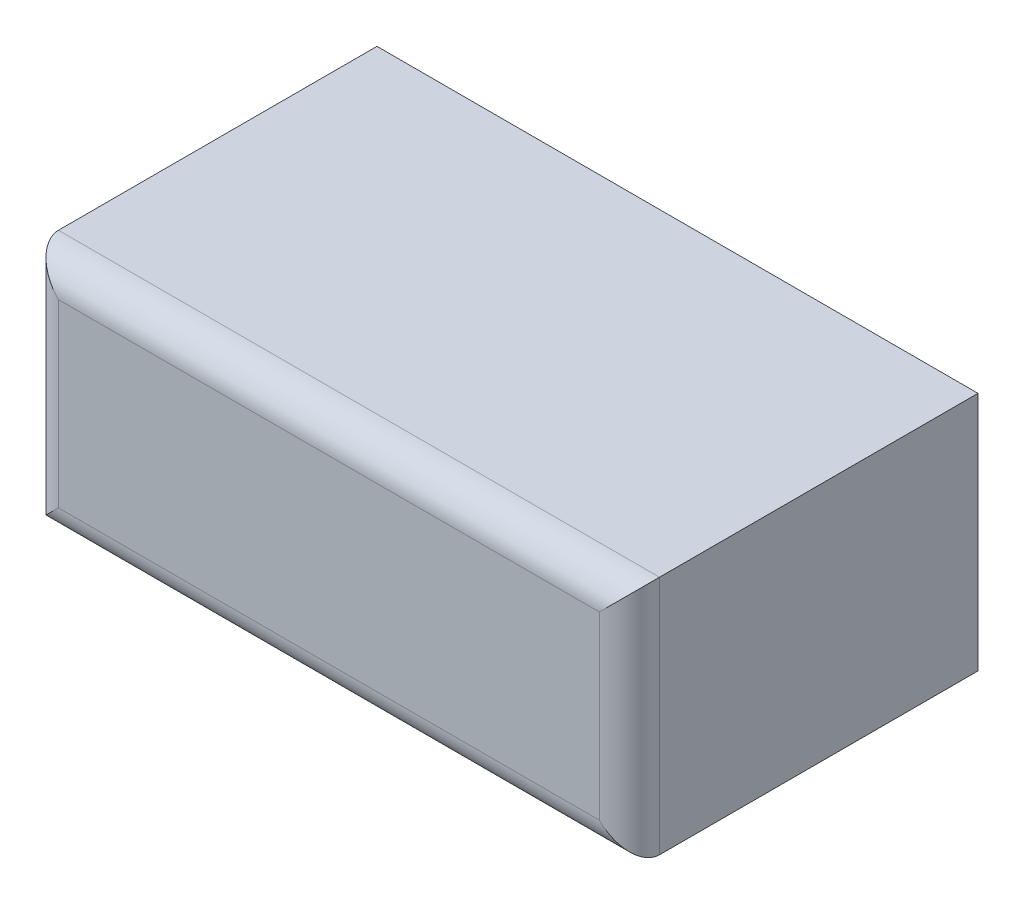
from build123d import *

# Parameters (mm, degrees)
SKETCH1_W           = 50
SKETCH1_H           = 20
BOSS_EXTRUDE1_DEPTH = 29
FILLET1_R           = 2.5
BOSS_EXTRUDE2_DEPTH = 0.1


with BuildPart() as part:
    # Sketch1 → Boss-Extrude1 (new body)
    with BuildSketch(Plane.XY):
        with Locations((0, 20)):
            Rectangle(SKETCH1_W, SKETCH1_H)
    extrude(amount=BOSS_EXTRUDE1_DEPTH)

    # Fillet1
    fillet1_edges = [part.edges().sort_by_distance(p)[0] for p in [
        (0, 10, 29),
        (-25, 20, 29),
        (0, 30, 29),
        (25, 20, 29),
    ]]
    fillet(fillet1_edges, radius=FILLET1_R)

    # Sketch2 → Boss-Extrude2 (add)
    # profile 1 of 7: a face of its own
    with BuildSketch(Plane(origin=(0, 10, 0), x_dir=(-1, 0, 0), z_dir=(0, -1, 0))):
        with BuildLine():
            Line((8.161378205, -16.425), (7.541897035, -16.425))
            add(Edge.make_bspline(
                [(7.541897035, -16.425), (7.511572152, -16.424843079), (7.45279498, -16.424538928), (7.367330986, -16.419712263), (7.287254193, -16.413295668), (7.212706107, -16.402532176), (7.143201655, -16.391371854), (7.079446453, -16.374991174), (7.020906472, -16.356898115), (6.950611937, -16.32905949), (6.870853154, -16.285825753), (6.785127387, -16.221706014), (6.71060932, -16.144831623), (6.647246874, -16.057227192), (6.596397164, -15.96085239), (6.560075042, -15.857780753), (6.536740327, -15.749746338), (6.534370666, -15.675678757), (6.533173077, -15.638246194)],
                knots=[0, 0, 0, 0, 1.00128172, 1.940733171, 2.826250472, 3.653024905, 4.427672124, 5.149348099, 5.824709082, 6.450061444, 7.643590664, 8.808605388, 9.972104426, 11.165284501, 12.367876273, 13.557044126, 14.765369432, 16, 16, 16, 16], degree=3))
            add(Edge.make_bspline(
                [(6.533173077, -15.638246194), (6.534151284, -15.603178326), (6.536073554, -15.534266659), (6.554852574, -15.433813262), (6.583199049, -15.337889273), (6.624104735, -15.247419107), (6.676262921, -15.163197724), (6.739721193, -15.086661725), (6.81496531, -15.019313764), (6.871459009, -14.981833665), (6.900155248, -14.962795473)],
                knots=[0, 0, 0, 0, 1.044356178, 2.052258378, 3.035953355, 4.020338374, 5.002448483, 5.980768927, 6.974322109, 8, 8, 8, 8], degree=3))
            add(Edge.make_bspline(
                [(6.900155248, -14.962795473), (6.864084301, -14.948954147), (6.795071643, -14.922472261), (6.699978414, -14.87547126), (6.618021504, -14.824742321), (6.548144713, -14.769913616), (6.489592899, -14.709194832), (6.437432592, -14.644185038), (6.393165743, -14.572620166), (6.355396245, -14.496050991), (6.3254768, -14.414882995), (6.304708546, -14.329723411), (6.291537252, -14.24153679), (6.289814866, -14.181600564), (6.288942308, -14.151236979)],
                knots=[0, 0, 0, 0, 1.272200328, 2.434034374, 3.488177493, 4.442517805, 5.351202203, 6.260825393, 7.183200622, 8.11705787, 9.069326169, 10.026320267, 11.000137371, 12, 12, 12, 12], degree=3))
            add(Edge.make_bspline(
                [(6.288942308, -14.151236979), (6.289828532, -14.120242797), (6.291572202, -14.059260874), (6.304434247, -13.969675123), (6.326218402, -13.884066271), (6.356202229, -13.801864469), (6.395287658, -13.723551149), (6.442506917, -13.648510856), (6.499179987, -13.577855697), (6.562999438, -13.51056038), (6.634203585, -13.44902172), (6.712664983, -13.396137418), (6.79637275, -13.350459073), (6.886473162, -13.313736246), (6.982326897, -13.284988989), (7.083956408, -13.265113183), (7.191303987, -13.251667075), (7.264973903, -13.250565121), (7.302754407, -13.25)],
                knots=[0, 0, 0, 0, 0.978522333, 1.925270105, 2.85076145, 3.763600118, 4.682725947, 5.609499657, 6.557784645, 7.537954401, 8.534920712, 9.522742111, 10.520247711, 11.5409147, 12.58930695, 13.675078472, 14.807699069, 16, 16, 16, 16], degree=3))
            Line((7.302754407, -13.25), (8.161378205, -13.25))
            Line((8.161378205, -13.25), (8.161378205, -16.425))
        make_face()
        with BuildLine():
            Line((7.876442308, -16.099358974), (7.876442308, -15.081730769))
            Line((7.876442308, -15.081730769), (7.685001002, -15.081730769))
            add(Edge.make_bspline(
                [(7.685001002, -15.081730769), (7.657016485, -15.082090538), (7.602944697, -15.082785683), (7.524432126, -15.084839708), (7.451736127, -15.090339202), (7.384606218, -15.096155836), (7.32349228, -15.105112222), (7.268189891, -15.11607244), (7.218201712, -15.127562175), (7.160582281, -15.147158708), (7.095231966, -15.175817169), (7.026054444, -15.221381864), (6.963791565, -15.274135929), (6.912428283, -15.336710494), (6.869666487, -15.404285365), (6.84087663, -15.477364451), (6.820803271, -15.553429425), (6.819016273, -15.605887766), (6.818108974, -15.632522035)],
                knots=[0, 0, 0, 0, 1.156584208, 2.234756387, 3.244705828, 4.168772894, 5.018724976, 5.795346628, 6.498686023, 7.135894168, 8.308330183, 9.43588092, 10.547699294, 11.667188675, 12.76860303, 13.837480448, 14.902040606, 16, 16, 16, 16], degree=3))
            add(Edge.make_bspline(
                [(6.818108974, -15.632522035), (6.818551479, -15.650154503), (6.819419499, -15.684742514), (6.827602669, -15.735135259), (6.838895347, -15.783089237), (6.857519785, -15.827311694), (6.879584931, -15.869355462), (6.907867177, -15.907892457), (6.940479208, -15.943966652), (6.97850075, -15.976611111), (7.021776377, -16.00613614), (7.07167696, -16.030714317), (7.126845823, -16.052556643), (7.188433408, -16.069113638), (7.255212949, -16.083487745), (7.328203262, -16.092551978), (7.406964459, -16.098374984), (7.46153509, -16.099023662), (7.48974359, -16.099358974)],
                knots=[0, 0, 0, 0, 0.911412742, 1.787835618, 2.63643285, 3.453173233, 4.262886967, 5.08783453, 5.918594724, 6.773969545, 7.67442701, 8.62112486, 9.645634318, 10.739428598, 11.916091468, 13.177237585, 14.540865421, 16, 16, 16, 16], degree=3))
            Line((7.48974359, -16.099358974), (7.876442308, -16.099358974))
        make_face(mode=Mode.SUBTRACT)
        with BuildLine():
            Line((7.876442308, -14.756089744), (7.876442308, -13.575641026))
            Line((7.876442308, -13.575641026), (7.470663061, -13.575641026))
            add(Edge.make_bspline(
                [(7.470663061, -13.575641026), (7.441620225, -13.576022613), (7.385643986, -13.576758072), (7.30476243, -13.578503216), (7.230195825, -13.584977694), (7.161323327, -13.591185023), (7.098463602, -13.601325985), (7.041005232, -13.611145936), (6.990260593, -13.625596478), (6.930886435, -13.64548068), (6.864477035, -13.67725827), (6.791954837, -13.723989938), (6.728077867, -13.780912554), (6.673882733, -13.846455715), (6.628821856, -13.916985641), (6.597648628, -13.992641147), (6.577450151, -14.070895217), (6.575071251, -14.12440248), (6.573878205, -14.151236979)],
                knots=[0, 0, 0, 0, 1.16016216, 2.236059617, 3.229676189, 4.14889023, 4.996733752, 5.772278665, 6.474820656, 7.101410824, 8.271817372, 9.403828207, 10.537358096, 11.673541442, 12.791884111, 13.865947414, 14.929748409, 16, 16, 16, 16], degree=3))
            add(Edge.make_bspline(
                [(6.573878205, -14.151236979), (6.574121742, -14.168015597), (6.574604888, -14.201302193), (6.582199463, -14.250174859), (6.592738789, -14.297751011), (6.608270797, -14.343384407), (6.627060302, -14.387860847), (6.651848446, -14.429733149), (6.67980929, -14.47078375), (6.723116409, -14.523292014), (6.786965959, -14.583060119), (6.877730349, -14.640845611), (6.980355591, -14.688202623), (7.054963889, -14.708222798), (7.093504607, -14.718564704)],
                knots=[0, 0, 0, 0, 0.723354195, 1.435040621, 2.129761981, 2.824182007, 3.512608497, 4.209435533, 4.920062464, 5.654614313, 7.143585817, 8.671381114, 10.280521501, 12, 12, 12, 12], degree=3))
            add(Edge.make_bspline(
                [(7.093504607, -14.718564704), (7.108952416, -14.721699169), (7.14244645, -14.728495336), (7.197063604, -14.735664702), (7.259625939, -14.742095856), (7.329866052, -14.746728084), (7.408063297, -14.751700699), (7.494192553, -14.753565733), (7.58831471, -14.755842106), (7.653622156, -14.756005086), (7.687545072, -14.756089744)],
                knots=[0, 0, 0, 0, 0.634452549, 1.375623993, 2.216454381, 3.166361212, 4.209414599, 5.370755378, 6.634280627, 8, 8, 8, 8], degree=3))
            Line((7.687545072, -14.756089744), (7.876442308, -14.756089744))
        make_face(mode=Mode.SUBTRACT)
    # profile 2 of 7: a face of its own
    with BuildSketch(Plane(origin=(0, 10, 0), x_dir=(-1, 0, 0), z_dir=(0, -1, 0))):
        Polygon((4.335096154, -16.425), (2.869711538, -13.25), (3.179452123, -13.25), (3.648833133, -14.267628205), (5.088141026, -14.267628205), (5.570242388, -13.25), (5.881891026, -13.25), (4.375801282, -16.425), align=None)
        Polygon((4.358628806, -15.80551883), (4.932952724, -14.593269231), (3.798933293, -14.593269231), align=None, mode=Mode.SUBTRACT)
    # profile 3 of 7: a face of its own
    with BuildSketch(Plane(origin=(0, 10, 0), x_dir=(-1, 0, 0), z_dir=(0, -1, 0))):
        Polygon((2.747596154, -16.099358974), (2.747596154, -16.425), (1.078685897, -16.425), (1.078685897, -16.099358974), (1.770673077, -16.099358974), (1.770673077, -13.25), (2.055608974, -13.25), (2.055608974, -16.099358974), align=None)
    # profile 4 of 7: a face of its own
    with BuildSketch(Plane(origin=(0, 10, 0), x_dir=(-1, 0, 0), z_dir=(0, -1, 0))):
        Polygon((0.875160256, -16.099358974), (0.875160256, -16.425), (-0.79375, -16.425), (-0.79375, -16.099358974), (-0.101762821, -16.099358974), (-0.101762821, -13.25), (0.183173077, -13.25), (0.183173077, -16.099358974), align=None)
    # profile 5 of 7: a face of its own
    with BuildSketch(Plane(origin=(0, 10, 0), x_dir=(-1, 0, 0), z_dir=(0, -1, 0))):
        Polygon((-1.363621795, -16.425), (-3.154647436, -16.425), (-3.154647436, -16.099358974), (-1.648557692, -16.099358974), (-1.648557692, -15.122435897), (-3.154647436, -15.122435897), (-3.154647436, -14.796794872), (-1.648557692, -14.796794872), (-1.648557692, -13.575641026), (-3.154647436, -13.575641026), (-3.154647436, -13.25), (-1.363621795, -13.25), align=None)
    # profile 6 of 7: a face of its own
    with BuildSketch(Plane(origin=(0, 10, 0), x_dir=(-1, 0, 0), z_dir=(0, -1, 0))):
        with BuildLine():
            Line((-3.724519231, -16.425), (-4.359900841, -16.425))
            add(Edge.make_bspline(
                [(-4.359900841, -16.425), (-4.402301722, -16.424858861), (-4.48371611, -16.424587859), (-4.600350434, -16.423076774), (-4.706329301, -16.418745752), (-4.801597298, -16.41501868), (-4.886152678, -16.408222418), (-4.96025472, -16.401726689), (-5.023562131, -16.393223439), (-5.061885154, -16.385326377), (-5.079236779, -16.381750801)],
                knots=[0, 0, 0, 0, 1.410062039, 2.707475311, 3.878576406, 4.937260626, 5.877586885, 6.699081471, 7.410979367, 8, 8, 8, 8], degree=3))
            add(Edge.make_bspline(
                [(-5.079236779, -16.381750801), (-5.102466036, -16.376012157), (-5.148429008, -16.364657289), (-5.214599465, -16.340645431), (-5.277679821, -16.312903072), (-5.337439075, -16.280069764), (-5.393861567, -16.242699938), (-5.446941612, -16.200643367), (-5.495967511, -16.153539711), (-5.542683531, -16.103340189), (-5.58347554, -16.047859177), (-5.620199169, -15.989912187), (-5.651027397, -15.928383597), (-5.675285773, -15.863583742), (-5.69562228, -15.796148276), (-5.70929031, -15.725410846), (-5.717802999, -15.651601594), (-5.718644053, -15.601380999), (-5.719070513, -15.575916466)],
                knots=[0, 0, 0, 0, 1.027276577, 2.032638556, 3.019345632, 3.985365262, 4.957888996, 5.923693931, 6.890056973, 7.876427719, 8.865527834, 9.843495157, 10.821038291, 11.815616373, 12.812734995, 13.843357168, 14.906466538, 16, 16, 16, 16], degree=3))
            add(Edge.make_bspline(
                [(-5.719070513, -15.575916466), (-5.717737956, -15.533611716), (-5.715137793, -15.45106419), (-5.690893823, -15.331266784), (-5.651184033, -15.219513991), (-5.596455684, -15.115961331), (-5.526793531, -15.022572769), (-5.443075465, -14.940823983), (-5.345729027, -14.871783409), (-5.25468041, -14.82441549), (-5.174214676, -14.793936941), (-5.107775832, -14.772384467), (-5.035247254, -14.756013281), (-4.957669472, -14.74113416), (-4.874443269, -14.729780196), (-4.785736242, -14.721716723), (-4.69132653, -14.716531849), (-4.626611174, -14.715774317), (-4.593319311, -14.715384615)],
                knots=[0, 0, 0, 0, 1.260402266, 2.459371274, 3.627181936, 4.786749125, 5.93865593, 7.087644312, 8.261344208, 9.485713728, 10.136162886, 10.825977872, 11.566646758, 12.35154167, 13.181268117, 14.0701832, 15.007234106, 16, 16, 16, 16], degree=3))
            Line((-4.593319311, -14.715384615), (-5.759775641, -13.25))
            Line((-5.759775641, -13.25), (-5.407421875, -13.25))
            Line((-5.407421875, -13.25), (-4.240965545, -14.715384615))
            Line((-4.240965545, -14.715384615), (-4.009455128, -14.715384615))
            Line((-4.009455128, -14.715384615), (-4.009455128, -13.25))
            Line((-4.009455128, -13.25), (-3.724519231, -13.25))
            Line((-3.724519231, -13.25), (-3.724519231, -16.425))
        make_face()
        with BuildLine():
            Line((-4.009455128, -16.099358974), (-4.009455128, -15.041025641))
            Line((-4.009455128, -15.041025641), (-4.59077524, -15.036573518))
            add(Edge.make_bspline(
                [(-4.59077524, -15.036573518), (-4.617916993, -15.036561503), (-4.670525441, -15.036538216), (-4.746635284, -15.040161235), (-4.817501543, -15.044282356), (-4.88285227, -15.050587465), (-4.942719599, -15.058708419), (-4.997063987, -15.068882483), (-5.046005526, -15.08068556), (-5.102903922, -15.099140582), (-5.167170754, -15.127118501), (-5.235574152, -15.170500695), (-5.295390964, -15.222965065), (-5.34512204, -15.28371599), (-5.385066096, -15.350797567), (-5.412810801, -15.422691639), (-5.4310944, -15.498265446), (-5.433109526, -15.550155937), (-5.434134615, -15.576552484)],
                knots=[0, 0, 0, 0, 1.146399208, 2.222048177, 3.218135709, 4.144938032, 4.994811973, 5.769438708, 6.479732432, 7.119818093, 8.294689872, 9.430121864, 10.527913442, 11.641375077, 12.733452768, 13.811150417, 14.886538365, 16, 16, 16, 16], degree=3))
            add(Edge.make_bspline(
                [(-5.434134615, -15.576552484), (-5.433057622, -15.602090441), (-5.430923414, -15.652697352), (-5.413101915, -15.726617823), (-5.384002229, -15.796906489), (-5.344172228, -15.862596132), (-5.294599519, -15.921783429), (-5.236858479, -15.972270277), (-5.172307881, -16.014213311), (-5.112465277, -16.041887428), (-5.058585859, -16.058170921), (-5.012020817, -16.06999109), (-4.958947573, -16.078269402), (-4.89999079, -16.085883237), (-4.834891476, -16.092330988), (-4.763609959, -16.096610688), (-4.686197207, -16.099168671), (-4.632542505, -16.099294064), (-4.604767628, -16.099358974)],
                knots=[0, 0, 0, 0, 1.100596872, 2.180981401, 3.259506136, 4.371595435, 5.481727359, 6.576991111, 7.667816242, 8.793363246, 9.406619729, 10.09427138, 10.864108636, 11.721733836, 12.6590937, 13.685439239, 14.801845161, 16, 16, 16, 16], degree=3))
            Line((-4.604767628, -16.099358974), (-4.009455128, -16.099358974))
        make_face(mode=Mode.SUBTRACT)
    # profile 7 of 7: a face of its own
    with BuildSketch(Plane(origin=(0, 10, 0), x_dir=(-1, 0, 0), z_dir=(0, -1, 0))):
        Polygon((-6.166826923, -16.425), (-6.493103966, -16.425), (-7.326287059, -15.062014223), (-8.16010617, -16.425), (-8.487019231, -16.425), (-7.469391026, -14.759269832), (-7.469391026, -13.25), (-7.184455128, -13.25), (-7.184455128, -14.759269832), align=None)
    extrude(amount=BOSS_EXTRUDE2_DEPTH)


solid = part.part
